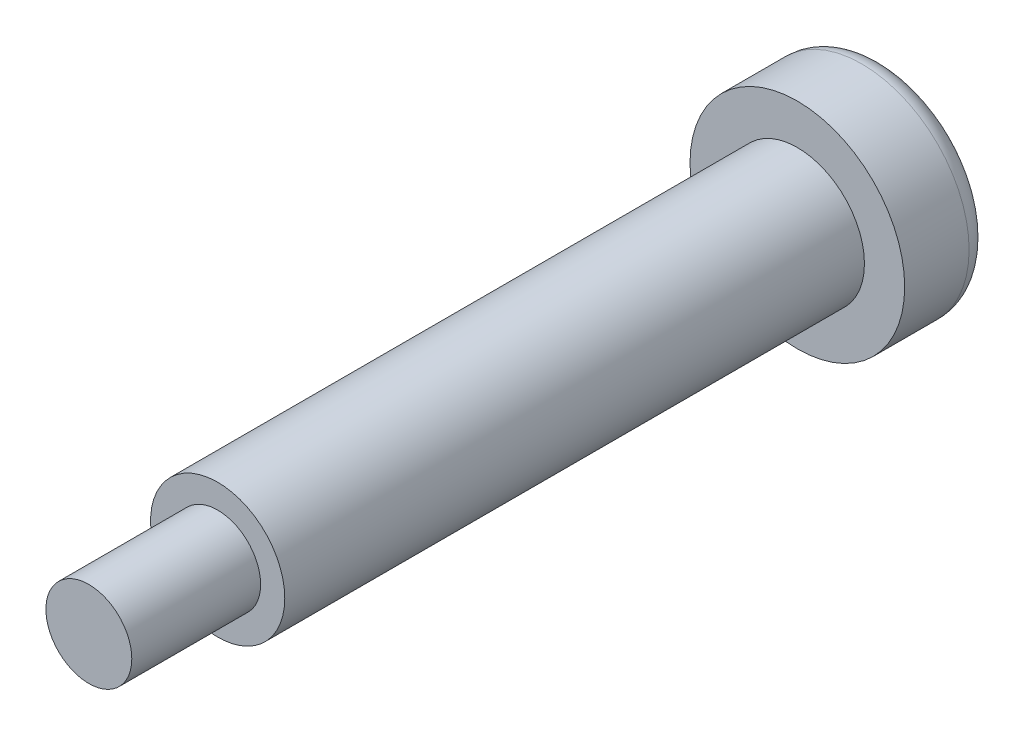
from build123d import *

# Parameters (mm, degrees)
IZIM1_R                     = 5
Y_KSEKLIK_EKSTR_ZYON1_DEPTH = 2
Y_KSEKLIK_EKSTR_ZYON2_DEPTH = 2
IZIM3_R                     = 3.125
Y_KSEKLIK_EKSTR_ZYON3_DEPTH = 27
IZIM4_R                     = 2
Y_KSEKLIK_EKSTR_ZYON4_DEPTH = 6
RADYUS1_R                   = 1
KES_EKSTR_ZYON1_DEPTH       = 2.5


with BuildPart() as part:
    # Çizim1 → Yükseklik-Ekstrüzyon1 (new, symmetric)
    with BuildSketch(Plane.XY):
        Circle(IZIM1_R)
    extrude(amount=Y_KSEKLIK_EKSTR_ZYON1_DEPTH, both=True)

    # Çizim2 → Yükseklik-Ekstrüzyon2 (add, symmetric)
    with BuildSketch(Plane.XY):
        Polygon((2.309401077, 0), (1.154700538, 2), (-1.154700538, 2), (-2.309401077, 0), (-1.154700538, -2), (1.154700538, -2), align=None)
    extrude(amount=Y_KSEKLIK_EKSTR_ZYON2_DEPTH, both=True)

    # Çizim3 → Yükseklik-Ekstrüzyon3 (add)
    with BuildSketch(Plane.XY.offset(2)):
        Circle(IZIM3_R)
    extrude(amount=Y_KSEKLIK_EKSTR_ZYON3_DEPTH)

    # Çizim4 → Yükseklik-Ekstrüzyon4 (add)
    with BuildSketch(Plane.XY.offset(29)):
        Circle(IZIM4_R)
    extrude(amount=Y_KSEKLIK_EKSTR_ZYON4_DEPTH)

    # Radyus1
    radyus1_edges = [part.edges().sort_by_distance(p)[0] for p in [
        (-5, 0, -2),
    ]]
    fillet(radyus1_edges, radius=RADYUS1_R)

    # Çizim5 → Kes-Ekstrüzyon1 (cut)
    with BuildSketch(Plane(origin=(0, 0, -2), x_dir=(-1, 0, 0), z_dir=(0, 0, -1))):
        Polygon((2.309401077, 0), (1.154700538, 2), (-1.154700538, 2), (-2.309401077, 0), (-1.154700538, -2), (1.154700538, -2), align=None)
    extrude(amount=-KES_EKSTR_ZYON1_DEPTH, mode=Mode.SUBTRACT)


solid = part.part
